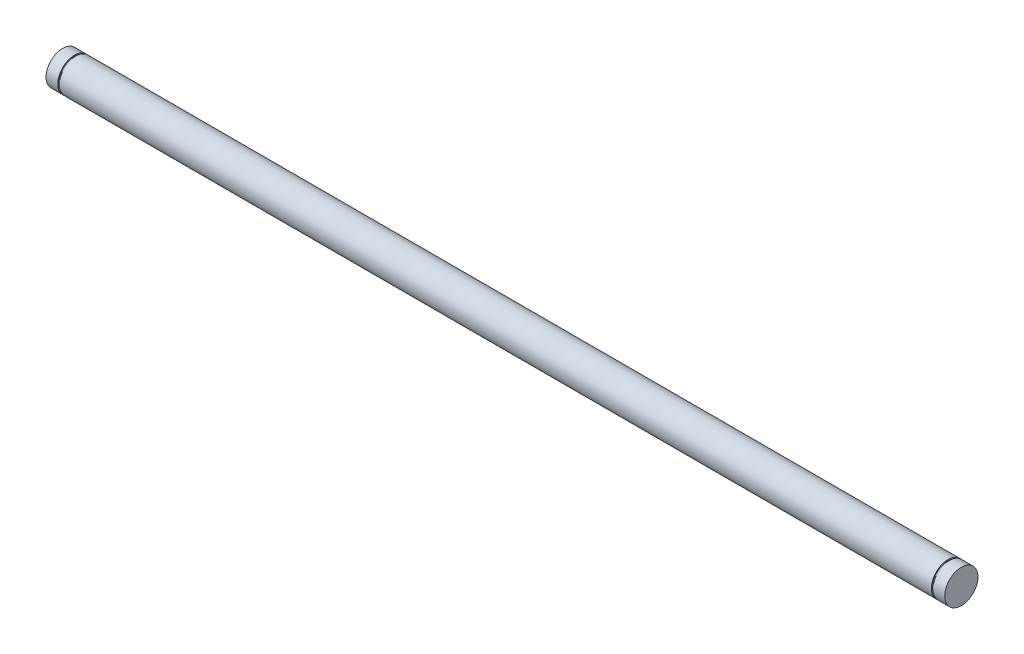
from build123d import *

# Parameters (mm, degrees)
SKETCH1_R           = 12.7
BOSS_EXTRUDE1_DEPTH = 685.8
CUT_EXTRUDE1_START  = 1.1684
SKETCH2_R           = 12.7
SKETCH2_R_2         = 11.938
CUT_EXTRUDE1_DEPTH  = 1.1684


with BuildPart() as part:
    # Sketch1 → Boss-Extrude1 (new body)
    with BuildSketch(Plane(origin=(0, 0, 0), x_dir=(0, 0, -1), z_dir=(1, 0, 0))):
        Circle(SKETCH1_R)
    extrude(amount=BOSS_EXTRUDE1_DEPTH)

    # Sketch2 → Cut-Extrude1 (cut)
    with BuildSketch(Plane.ZY.offset(-10.16).offset(CUT_EXTRUDE1_START)):
        Circle(SKETCH2_R)
        Circle(SKETCH2_R_2, mode=Mode.SUBTRACT)
    cut_extrude1 = extrude(amount=-CUT_EXTRUDE1_DEPTH, mode=Mode.SUBTRACT)

    # Mirror1: Cut-Extrude1 across plane
    add(cut_extrude1.mirror(Plane.ZY.offset(-342.9)), mode=Mode.SUBTRACT)


solid = part.part
